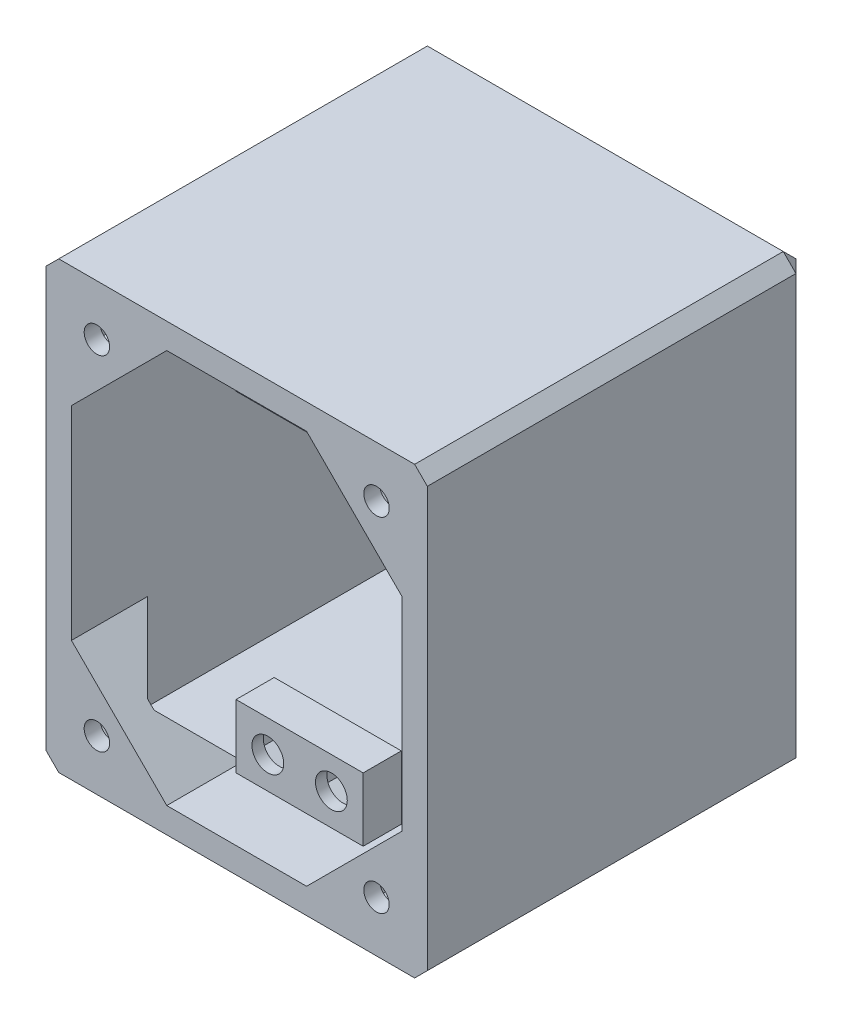
from build123d import *

# Parameters (mm, degrees)
SKIZZE1_W                          = 60
SKIZZE1_H                          = 70
GRUNDK_RPER_DEPTH                  = 60
FASE2_SIZE                         = 2
WANDUNG1_T                         = -4
SKIZZE2_W                          = 20
SKIZZE2_H                          = 6
AUFSATZ_LINEAR_AUSTRAGEN1_DEPTH    = 10
BOHRUNGEN_SERVO_REACH              = 106.929
SKIZZE3_R                          = 2.5
SECHSKANT_START                    = -4.2
SKIZZE5_R                          = 2.5
SKIZZE5_R_2                        = 2
SECHSKANT_DEPTH                    = 4.2
AUSPARUNGEN_DEPTH                  = 5
FASE3_SIZE                         = 7
BOHRUNGENHALTERUNG_REACH           = 112
SKIZZE8_R                          = 2
SECHSKANT_START_2                  = -9.5
SECHSKANT_DECKEL_DEPTH             = 9.5
BOHRUNG_VERSCHRAUBUNG_DECKEL_REACH = 112
SKIZZE11_R                         = 3
SKIZZE14_W                         = 12
SKIZZE14_H                         = 20
SKIZZE14_R                         = 0.883929471
VERTIEFUNG_DECKEL_DEPTH            = 2


with BuildPart() as part:
    # Skizze1 → Grundkörper (new body)
    with BuildSketch(Plane.XY):
        with Locations((30, 35)):
            Rectangle(SKIZZE1_W, SKIZZE1_H)
    extrude(amount=GRUNDK_RPER_DEPTH)

    # Fase2
    fase2_edges = [part.edges().sort_by_distance(p)[0] for p in [
        (30, 70, 0),
        (60, 35, 0),
        (0, 35, 0),
        (0, 70, 30),
        (60, 70, 30),
        (60, 0, 30),
        (0, 0, 30),
    ]]
    chamfer(fase2_edges, length=FASE2_SIZE)

    # Wandung1
    wandung1_openings = [part.faces().sort_by_distance(p)[0] for p in [
        (30, 35, 60),
    ]]
    offset(amount=WANDUNG1_T, openings=wandung1_openings)

    # Skizze2 → Aufsatz-Linear austragen1 (add)
    with BuildSketch(Plane(origin=(0, 4, 0), x_dir=(1, 0, 0), z_dir=(0, 1, 0))):
        with Locations((30, -47.1)):
            Rectangle(SKIZZE2_W, SKIZZE2_H)
    aufsatz_linear_austragen1 = extrude(amount=AUFSATZ_LINEAR_AUSTRAGEN1_DEPTH)

    # Spiegeln1: Aufsatz-Linear austragen1 across plane
    add(aufsatz_linear_austragen1.mirror(Plane(origin=(0, 35, 0), x_dir=(0, 0, 1), z_dir=(0, -1, 0))))

    # Skizze3 → Bohrungen Servo (cut, up to next)
    with BuildSketch(Plane.XY.offset(50.1), mode=Mode.PRIVATE) as bohrungen_servo_sk1:
        with Locations((25, 9)):
            Circle(SKIZZE3_R)
    bohrungen_servo_tool1 = extrude(bohrungen_servo_sk1.sketch, amount=-BOHRUNGEN_SERVO_REACH, mode=Mode.PRIVATE) & part.part
    # Skizze3 → Bohrungen Servo (cut, up to next)
    with BuildSketch(Plane.XY.offset(50.1), mode=Mode.PRIVATE) as bohrungen_servo_sk2:
        with Locations((35, 9)):
            Circle(SKIZZE3_R)
    bohrungen_servo_tool2 = extrude(bohrungen_servo_sk2.sketch, amount=-BOHRUNGEN_SERVO_REACH, mode=Mode.PRIVATE) & part.part
    # Skizze3 → Bohrungen Servo (cut, up to next)
    with BuildSketch(Plane.XY.offset(50.1), mode=Mode.PRIVATE) as bohrungen_servo_sk3:
        with Locations((35, 61)):
            Circle(SKIZZE3_R)
    bohrungen_servo_tool3 = extrude(bohrungen_servo_sk3.sketch, amount=-BOHRUNGEN_SERVO_REACH, mode=Mode.PRIVATE) & part.part
    # Skizze3 → Bohrungen Servo (cut, up to next)
    with BuildSketch(Plane.XY.offset(50.1), mode=Mode.PRIVATE) as bohrungen_servo_sk4:
        with Locations((25, 61)):
            Circle(SKIZZE3_R)
    bohrungen_servo_tool4 = extrude(bohrungen_servo_sk4.sketch, amount=-BOHRUNGEN_SERVO_REACH, mode=Mode.PRIVATE) & part.part
    add(bohrungen_servo_tool1.solids().sort_by_distance((25, 9, 50.1))[0], mode=Mode.SUBTRACT)
    add(bohrungen_servo_tool2.solids().sort_by_distance((35, 9, 50.1))[0], mode=Mode.SUBTRACT)
    add(bohrungen_servo_tool3.solids().sort_by_distance((35, 61, 50.1))[0], mode=Mode.SUBTRACT)
    add(bohrungen_servo_tool4.solids().sort_by_distance((25, 61, 50.1))[0], mode=Mode.SUBTRACT)

    # Skizze5 → Sechskant (cut)
    # profile 1 of 4: a face of its own
    with BuildSketch(Plane(origin=(0, 0, 44.1), x_dir=(-1, 0, 0), z_dir=(0, 0, -1)).offset(SECHSKANT_START)):
        Polygon((-34.978654144, 13.041395512), (-38.489278252, 11.03918381), (-38.510624109, 6.997788298), (-35.021345856, 4.958604488), (-31.510721748, 6.96081619), (-31.489375891, 11.002211702), align=None)
        with Locations(Location((-35, 9, 0), (0, 0, 180))):
            Circle(SKIZZE5_R, mode=Mode.SUBTRACT)
    # profile 2 of 4: a face of its own
    with BuildSketch(Plane(origin=(0, 0, 44.1), x_dir=(-1, 0, 0), z_dir=(0, 0, -1)).offset(SECHSKANT_START)):
        Polygon((-31.489375891, 58.997788298), (-34.978654144, 56.958604488), (-38.489278252, 58.96081619), (-38.510624109, 63.002211702), (-35.021345856, 65.041395512), (-31.510721748, 63.03918381), align=None)
        with Locations((-35, 61)):
            Circle(SKIZZE5_R, mode=Mode.SUBTRACT)
    # profile 3 of 4: a face of its own
    with BuildSketch(Plane(origin=(0, 0, 44.1), x_dir=(-1, 0, 0), z_dir=(0, 0, -1)).offset(SECHSKANT_START)):
        Polygon((-28.489278252, 63.03918381), (-28.510624109, 58.997788298), (-25.021345856, 56.958604488), (-21.510721748, 58.96081619), (-21.489375891, 63.002211702), (-24.978654144, 65.041395512), align=None)
        with Locations((-25, 61)):
            Circle(SKIZZE5_R, mode=Mode.SUBTRACT)
    # profile 4 of 4: a face of its own
    with BuildSketch(Plane(origin=(0, 0, 44.1), x_dir=(-1, 0, 0), z_dir=(0, 0, -1)).offset(SECHSKANT_START)):
        Polygon((-28.510624109, 11.002211702), (-25.021345856, 13.041395512), (-21.510721748, 11.03918381), (-21.489375891, 6.997788298), (-24.978654144, 4.958604488), (-28.489278252, 6.96081619), align=None)
        with Locations((-25, 9)):
            Circle(SKIZZE5_R_2, mode=Mode.SUBTRACT)
    extrude(amount=SECHSKANT_DEPTH, mode=Mode.SUBTRACT)

    # Skizze7 → Ausparungen (add)
    with BuildSketch(Plane.XY.offset(60)):
        Polygon((56, 4), (41, 4), (56, 19), align=None)
        Polygon((19, 4), (4, 19), (4, 4), align=None)
        Polygon((4, 66), (19, 66), (4, 51), align=None)
        Polygon((41, 66), (56, 51), (56, 66), align=None)
    extrude(amount=-AUSPARUNGEN_DEPTH)

    # Fase3
    fase3_edges = [part.edges().sort_by_distance(p)[0] for p in [
        (56, 11.5, 55),
        (48.5, 4, 55),
        (11.5, 4, 55),
        (4, 11.5, 55),
        (4, 58.5, 55),
        (11.5, 66, 55),
        (48.5, 66, 55),
        (56, 58.5, 55),
    ]]
    chamfer(fase3_edges, length=FASE3_SIZE)

    # Skizze8 → BohrungenHalterung (cut, up to next)
    with BuildSketch(Plane.XY.offset(60), mode=Mode.PRIVATE) as bohrungenhalterung_sk1:
        with Locations((52, 8)):
            Circle(SKIZZE8_R)
    bohrungenhalterung_tool1 = extrude(bohrungenhalterung_sk1.sketch, amount=-BOHRUNGENHALTERUNG_REACH, mode=Mode.PRIVATE) & part.part
    # Skizze8 → BohrungenHalterung (cut, up to next)
    with BuildSketch(Plane.XY.offset(60), mode=Mode.PRIVATE) as bohrungenhalterung_sk2:
        with Locations(Location((8, 8, 0), (0, 0, 45))):
            Circle(SKIZZE8_R)
    bohrungenhalterung_tool2 = extrude(bohrungenhalterung_sk2.sketch, amount=-BOHRUNGENHALTERUNG_REACH, mode=Mode.PRIVATE) & part.part
    # Skizze8 → BohrungenHalterung (cut, up to next)
    with BuildSketch(Plane.XY.offset(60), mode=Mode.PRIVATE) as bohrungenhalterung_sk3:
        with Locations((8, 62)):
            Circle(SKIZZE8_R)
    bohrungenhalterung_tool3 = extrude(bohrungenhalterung_sk3.sketch, amount=-BOHRUNGENHALTERUNG_REACH, mode=Mode.PRIVATE) & part.part
    # Skizze8 → BohrungenHalterung (cut, up to next)
    with BuildSketch(Plane.XY.offset(60), mode=Mode.PRIVATE) as bohrungenhalterung_sk4:
        with Locations(Location((52, 62, 0), (0, 0, 45))):
            Circle(SKIZZE8_R)
    bohrungenhalterung_tool4 = extrude(bohrungenhalterung_sk4.sketch, amount=-BOHRUNGENHALTERUNG_REACH, mode=Mode.PRIVATE) & part.part
    add(bohrungenhalterung_tool1.solids().sort_by_distance((52, 8, 60))[0], mode=Mode.SUBTRACT)
    add(bohrungenhalterung_tool2.solids().sort_by_distance((8, 8, 60))[0], mode=Mode.SUBTRACT)
    add(bohrungenhalterung_tool3.solids().sort_by_distance((8, 62, 60))[0], mode=Mode.SUBTRACT)
    add(bohrungenhalterung_tool4.solids().sort_by_distance((52, 62, 60))[0], mode=Mode.SUBTRACT)

    # Skizze13 → Sechskant Deckel (cut)
    with BuildSketch(Plane.XY.offset(57.5).offset(SECHSKANT_START_2)):
        Polygon((50.909166509, 57.928953988), (54.98021252, 59.01978748), (56.071046012, 63.090833491), (53.090833491, 66.071046012), (49.01978748, 64.98021252), (47.928953988, 60.909166509), align=None)
        Polygon((49.01978748, 5.01978748), (53.090833491, 3.928953988), (56.071046012, 6.909166509), (54.98021252, 10.98021252), (50.909166509, 12.071046012), (47.928953988, 9.090833491), align=None)
        Polygon((3.928953988, 6.909166509), (6.909166509, 3.928953988), (10.98021252, 5.01978748), (12.071046012, 9.090833491), (9.090833491, 12.071046012), (5.01978748, 10.98021252), align=None)
        Polygon((5.01978748, 59.01978748), (9.090833491, 57.928953988), (12.071046012, 60.909166509), (10.98021252, 64.98021252), (6.909166509, 66.071046012), (3.928953988, 63.090833491), align=None)
    extrude(amount=SECHSKANT_DECKEL_DEPTH, mode=Mode.SUBTRACT)

    # Skizze11 → Bohrung Verschraubung Deckel (cut, up to next)
    with BuildSketch(Plane(origin=(0, 0, 0), x_dir=(-1, 0, 0), z_dir=(0, 0, -1)), mode=Mode.PRIVATE) as bohrung_verschraubung_deckel_sk1:
        with Locations((-30, 35)):
            Circle(SKIZZE11_R)
    bohrung_verschraubung_deckel_tool1 = extrude(bohrung_verschraubung_deckel_sk1.sketch, amount=-BOHRUNG_VERSCHRAUBUNG_DECKEL_REACH, mode=Mode.PRIVATE) & part.part
    add(bohrung_verschraubung_deckel_tool1.solids().sort_by_distance((30, 35, 0))[0], mode=Mode.SUBTRACT)

    # Skizze14 → Vertiefung Deckel (cut)
    with BuildSketch(Plane(origin=(0, 0, 0), x_dir=(-1, 0, 0), z_dir=(0, 0, -1))):
        with Locations((-30, 30)):
            Rectangle(SKIZZE14_W, SKIZZE14_H)
        with Locations((-30, 35)):
            Circle(SKIZZE14_R, mode=Mode.SUBTRACT)
    extrude(amount=-VERTIEFUNG_DECKEL_DEPTH, mode=Mode.SUBTRACT)


solid = part.part
